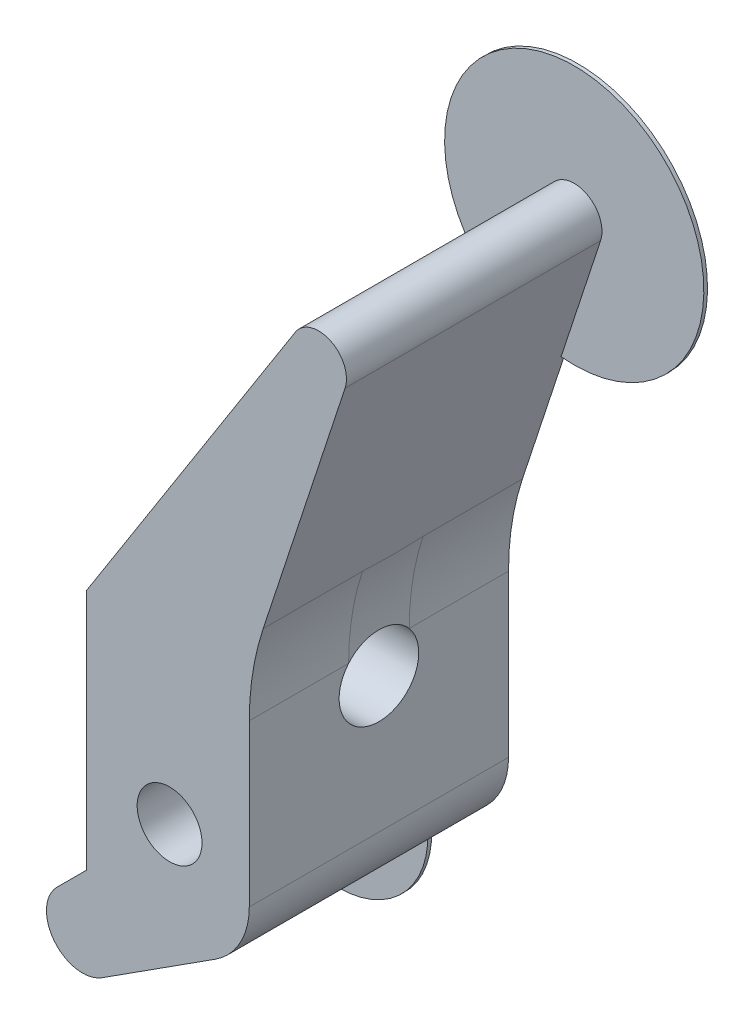
from build123d import *

# Parameters (mm, degrees)
BOSS_EXTRUDE1_DEPTH        = 13.799999061
BOSS_EXTRUDE2_DEPTH        = 0.2
CUT_EXTRUDE1_DEPTH         = 3.400001203
F_4_3_4_3_DIAMETER_HOLE1_D = 4.3
FILLET1_R                  = 3
FILLET2_R                  = 4
FILLET3_R                  = 15
SKETCH8_R                  = 1.75
CUT_EXTRUDE2_DEPTH         = 50.443502835


with BuildPart() as part:
    # Sketch1 → Boss-Extrude1 (new body)
    with BuildSketch(Plane.XY.offset(36.05999958)):
        with BuildLine():
            Line((32.485525439, 18.054212076), (21.200000344, 0.318097361))
            Line((21.200000344, 0.318097361), (21.200000344, -12.753243365))
            Line((21.200000344, -12.753243365), (19.621141825, -14.332101884))
            ThreePointArc((19.621141825, -14.332101884), (19.48110052, -16.933843676), (22.052777974, -17.352349348))
            Line((22.052777974, -17.352349348), (30.004000079, -12.252479732))
            Line((30.004000079, -12.252479732), (30.004000079, 1.043246227))
            Line((30.004000079, 1.043246227), (35.17606489, 16.780626974))
            ThreePointArc((35.17606489, 16.780626974), (34.392817656, 18.604732161), (32.485525439, 18.054212076))
        make_face()
    extrude(amount=-BOSS_EXTRUDE1_DEPTH)

    # Sketch2 → Boss-Extrude2 (add)
    with BuildSketch(Plane(origin=(0, 0, 22.260000519), x_dir=(-1, 0, 0), z_dir=(0, 0, -1))):
        with BuildLine():
            Line((-28.814945272, 12.285604299), (-21.19999872, 0.318097361))
            Line((-21.19999872, 0.318097361), (-21.19999872, -10.863853544))
            ThreePointArc((-21.19999872, -10.863853544), (-17.77320484, -19.33342263), (-25.791833238, -14.954140106))
            Line((-25.791833238, -14.954140106), (-30.004000079, -12.252479732))
            Line((-30.004000079, -12.252479732), (-30.004000079, 1.043246227))
            Line((-30.004000079, 1.043246227), (-33.041298024, 10.285031848))
            ThreePointArc((-33.041298024, 10.285031848), (-36.745962089, 23.575923167), (-28.814945272, 12.285604299))
        make_face()
    extrude(amount=BOSS_EXTRUDE2_DEPTH)

    # Sketch3 → Cut-Extrude1 (cut)
    with BuildSketch(Plane.ZY.offset(-21.200000344)):
        Polygon((29.060742246, -7.024871659), (32.760371092, -4.888032935), (32.759628896, -0.615641007), (29.059257854, 1.519912196), (25.359629008, -0.616926528), (25.360371203, -4.889318456), align=None)
    extrude(amount=-CUT_EXTRUDE1_DEPTH, mode=Mode.SUBTRACT)

    # Ø4.3 (4.3) Diameter Hole1 (through all)
    with Locations(Plane.ZY.offset(-24.600001547)):
        with Locations((29.06000005, -2.752479732)):
            Hole(F_4_3_4_3_DIAMETER_HOLE1_D / 2)

    # Fillet1
    fillet1_edges = [part.edges().sort_by_distance(p)[0] for p in [
        (21.200000344, 0.318097361, 24.619244439),
        (21.19999872, 0.318097361, 22.160000519),
    ]]
    fillet(fillet1_edges, radius=FILLET1_R)

    # Fillet2
    fillet2_edges = [part.edges().sort_by_distance(p)[0] for p in [
        (30.004000079, -12.252479732, 29.06000005),
    ]]
    fillet(fillet2_edges, radius=FILLET2_R)

    # Fillet3
    fillet3_edges = [part.edges().sort_by_distance(p)[0] for p in [
        (30.004000079, 1.043246227, 29.06000005),
    ]]
    fillet(fillet3_edges, radius=FILLET3_R)

    # Sketch8 → Cut-Extrude2 (cut, through all)
    with BuildSketch(Plane.XY.offset(36.05999958)):
        with Locations((25.700000344, -8.352349348)):
            Circle(SKETCH8_R)
    extrude(amount=-CUT_EXTRUDE2_DEPTH, mode=Mode.SUBTRACT)


solid = part.part
